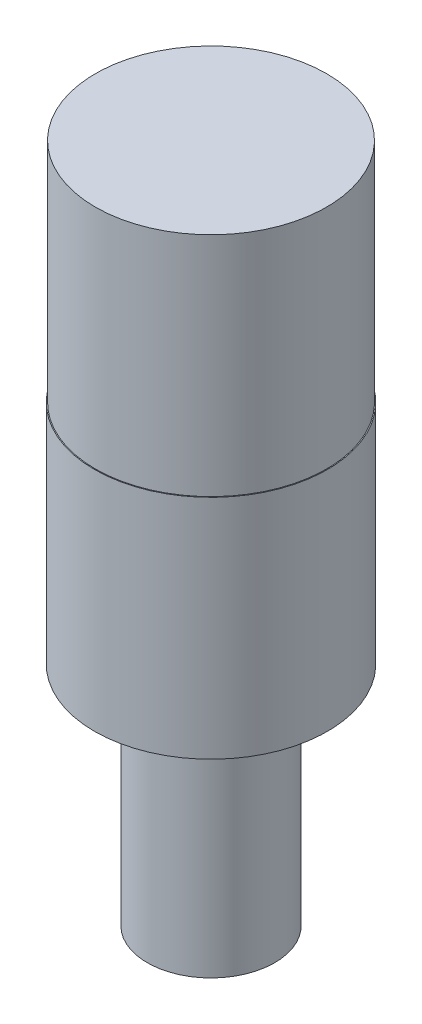
from build123d import *

# Parameters (mm, degrees)
SKETCH1_R           = 7.14375
BOSS_EXTRUDE1_DEPTH = 38.1
SKETCH2_R           = 8.527519915
SKETCH2_R_2         = 6.475
CUT_EXTRUDE1_DEPTH  = 12.7
SKETCH3_R           = 7.783407402
SKETCH3_R_2         = 6.525
CUT_EXTRUDE2_DEPTH  = 12.7
SKETCH4_R           = 8.894302058
SKETCH4_R_2         = 3.5687
CUT_EXTRUDE3_DEPTH  = 12.7


with BuildPart() as part:
    # Sketch1 → Boss-Extrude1 (new body)
    with BuildSketch(Plane(origin=(0, 0, 0), x_dir=(1, 0, 0), z_dir=(0, 1, 0))):
        with Locations(Location((0, 0, 0), (0, 0, 90))):
            Circle(SKETCH1_R)
    extrude(amount=BOSS_EXTRUDE1_DEPTH)

    # Sketch2 → Cut-Extrude1 (cut)
    with BuildSketch(Plane(origin=(0, 38.1, 0), x_dir=(1, 0, 0), z_dir=(0, 1, 0))):
        Circle(SKETCH2_R)
        with Locations(Location((0, 0, 0), (0, 0, 270))):
            Circle(SKETCH2_R_2, mode=Mode.SUBTRACT)
    extrude(amount=-CUT_EXTRUDE1_DEPTH, mode=Mode.SUBTRACT)

    # Sketch3 → Cut-Extrude2 (cut)
    with BuildSketch(Plane(origin=(0, 25.4, 0), x_dir=(1, 0, 0), z_dir=(0, 1, 0))):
        Circle(SKETCH3_R)
        with Locations(Location((0, 0, 0), (0, 0, 270))):
            Circle(SKETCH3_R_2, mode=Mode.SUBTRACT)
    extrude(amount=-CUT_EXTRUDE2_DEPTH, mode=Mode.SUBTRACT)

    # Sketch4 → Cut-Extrude3 (cut)
    with BuildSketch(Plane.XZ):
        Circle(SKETCH4_R)
        with Locations(Location((0, 0, 0), (0, 0, 270))):
            Circle(SKETCH4_R_2, mode=Mode.SUBTRACT)
    extrude(amount=-CUT_EXTRUDE3_DEPTH, mode=Mode.SUBTRACT)


solid = part.part
